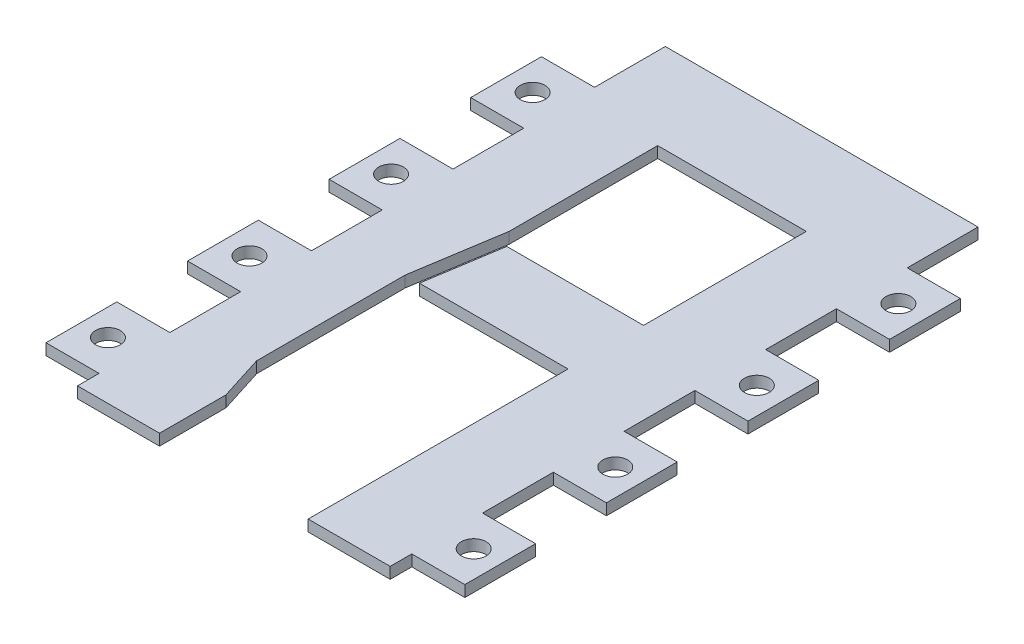
from build123d import *

# Parameters (mm, degrees)
BOSS_EXTRUDE1_DEPTH = 3.175
SKETCH3_W           = 15
SKETCH3_H           = 20
SKETCH3_R           = 3.5
BOSS_EXTRUDE3_DEPTH = 3.175
SKETCH4_W           = 23.175
SKETCH4_H           = 6.096
BOSS_EXTRUDE4_DEPTH = 3.175


with BuildPart() as part:
    # Sketch1 → Boss-Extrude1 (new body)
    with BuildSketch(Plane(origin=(0, 0, 0), x_dir=(1, 0, 0), z_dir=(0, 1, 0))):
        Polygon((0, 160), (0, 0), (23.175, 0), (23.175, 12.666666667), (19.175, 25.333333333), (19.175, 67.333333333), (23.175, 92.666666667), (23.175, 134.666666667), (65.175, 134.666666667), (65.175, 92.666666667), (65.175, 88.666666667), (26.543421053, 88.666666667), (23.175, 67.333333333), (65.175, 67.333333333), (65.175, 25.333333333), (65.175, 0), (88.35, 0), (88.35, 160), align=None)
    extrude(amount=BOSS_EXTRUDE1_DEPTH)

    # Sketch3 → Boss-Extrude3 (add)
    # profile 1 of 8: a face of its own
    with BuildSketch(Plane(origin=(0, 3.175, 0), x_dir=(1, 0, 0), z_dir=(0, 1, 0))):
        with Locations((-7.5, 130)):
            Rectangle(SKETCH3_W, SKETCH3_H)
        with Locations(Location((-7.5, 130, 0), (0, 0, 270))):
            Circle(SKETCH3_R, mode=Mode.SUBTRACT)
    # profile 2 of 8: a face of its own
    with BuildSketch(Plane(origin=(0, 3.175, 0), x_dir=(1, 0, 0), z_dir=(0, 1, 0))):
        with Locations((-7.5, 90)):
            Rectangle(SKETCH3_W, SKETCH3_H)
        with Locations(Location((-7.5, 90, 0), (0, 0, 270))):
            Circle(SKETCH3_R, mode=Mode.SUBTRACT)
    # profile 3 of 8: a face of its own
    with BuildSketch(Plane(origin=(0, 3.175, 0), x_dir=(1, 0, 0), z_dir=(0, 1, 0))):
        with Locations((-7.5, 50)):
            Rectangle(SKETCH3_W, SKETCH3_H)
        with Locations(Location((-7.5, 50, 0), (0, 0, 270))):
            Circle(SKETCH3_R, mode=Mode.SUBTRACT)
    # profile 4 of 8: a face of its own
    with BuildSketch(Plane(origin=(0, 3.175, 0), x_dir=(1, 0, 0), z_dir=(0, 1, 0))):
        with Locations((-7.5, 10)):
            Rectangle(SKETCH3_W, SKETCH3_H)
        with Locations(Location((-7.5, 10, 0), (0, 0, 270))):
            Circle(SKETCH3_R, mode=Mode.SUBTRACT)
    # profile 5 of 8: a face of its own
    with BuildSketch(Plane(origin=(0, 3.175, 0), x_dir=(1, 0, 0), z_dir=(0, 1, 0))):
        with Locations((95.85, 10)):
            Rectangle(SKETCH3_W, SKETCH3_H)
        with Locations(Location((95.85, 10, 0), (0, 0, 270))):
            Circle(SKETCH3_R, mode=Mode.SUBTRACT)
    # profile 6 of 8: a face of its own
    with BuildSketch(Plane(origin=(0, 3.175, 0), x_dir=(1, 0, 0), z_dir=(0, 1, 0))):
        with Locations((95.85, 50)):
            Rectangle(SKETCH3_W, SKETCH3_H)
        with Locations(Location((95.85, 50, 0), (0, 0, 270))):
            Circle(SKETCH3_R, mode=Mode.SUBTRACT)
    # profile 7 of 8: a face of its own
    with BuildSketch(Plane(origin=(0, 3.175, 0), x_dir=(1, 0, 0), z_dir=(0, 1, 0))):
        with Locations((95.85, 90)):
            Rectangle(SKETCH3_W, SKETCH3_H)
        with Locations(Location((95.85, 90, 0), (0, 0, 270))):
            Circle(SKETCH3_R, mode=Mode.SUBTRACT)
    # profile 8 of 8: a face of its own
    with BuildSketch(Plane(origin=(0, 3.175, 0), x_dir=(1, 0, 0), z_dir=(0, 1, 0))):
        with Locations((95.85, 130)):
            Rectangle(SKETCH3_W, SKETCH3_H)
        with Locations(Location((95.85, 130, 0), (0, 0, 270))):
            Circle(SKETCH3_R, mode=Mode.SUBTRACT)
    extrude(amount=-BOSS_EXTRUDE3_DEPTH)

    # Sketch4 → Boss-Extrude4 (add)
    with BuildSketch(Plane(origin=(0, 3.175, 0), x_dir=(1, 0, 0), z_dir=(0, 1, 0))):
        with Locations((11.5875, -3.048)):
            Rectangle(SKETCH4_W, SKETCH4_H)
        with Locations((76.7625, -3.048)):
            Rectangle(SKETCH4_W, SKETCH4_H)
    extrude(amount=-BOSS_EXTRUDE4_DEPTH)


solid = part.part
